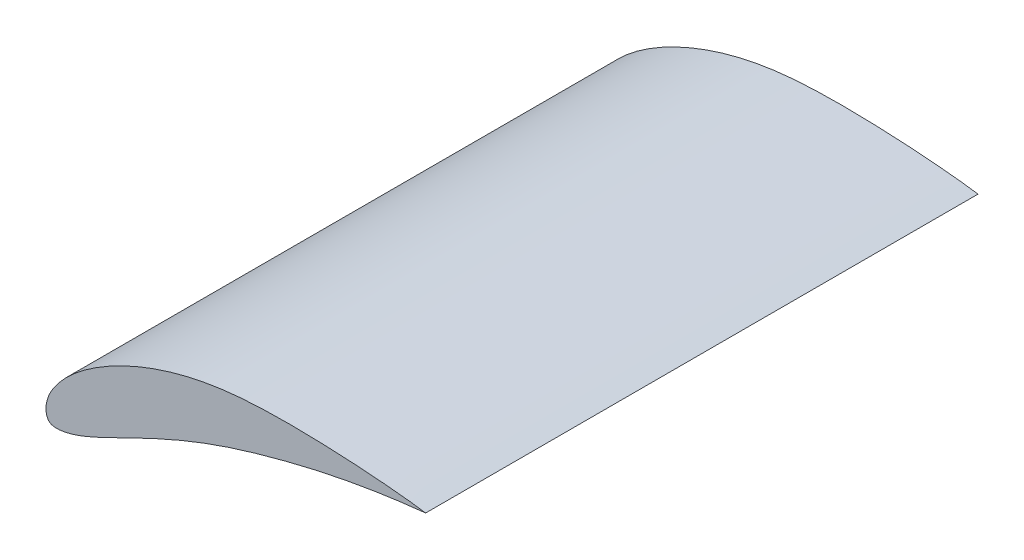
from build123d import *

# Parameters (mm, degrees)
BOSS_EXTRUDE1_DEPTH = 254


with BuildPart() as part:
    # Sketch4 → Boss-Extrude1 (new body)
    with BuildSketch(Plane.XY):
        with BuildLine():
            add(Edge.make_bspline(
                [(643.643746682, 374.253016038), (644.070127169, 375.272815676), (644.568425729, 376.247168181), (645.66595731, 378.132089752), (646.264693913, 379.04297252), (647.541990898, 380.814295075), (648.221792144, 381.676928327), (649.639946963, 383.35186971), (650.374220485, 384.159209796), (652.637702456, 386.508688506), (654.227739569, 387.97808557), (657.526822975, 390.774563344), (659.236808225, 392.100521211), (662.754760091, 394.635266564), (664.564078818, 395.844343958), (668.263555084, 398.158009043), (670.138940349, 399.253043278), (675.831208738, 402.378843705), (679.71306976, 404.25304174), (687.624134138, 407.646407586), (691.655458911, 409.160463714), (697.813800993, 411.163231515), (699.885031735, 411.786364282), (703.019109794, 412.655446416), (704.068342859, 412.934200147), (706.175837552, 413.46995274), (707.234104449, 413.726915239), (712.523410363, 414.952098085), (716.767976429, 415.746567548), (725.281236207, 416.994082048), (729.550126331, 417.444347706), (738.108101863, 418.059100463), (742.396452254, 418.233988614), (750.984850002, 418.418244009), (755.284956147, 418.426779362), (763.894434315, 418.312730873), (768.20498599, 418.190722932), (776.827909215, 417.846034605), (781.135734712, 417.62379177), (789.744487104, 417.084636103), (794.045530081, 416.769316274), (800.491212623, 416.215618502), (802.638777841, 416.01738948), (806.931247773, 415.584421162), (809.077241324, 415.350690101), (813.166057632, 414.850938767), (815.109802966, 414.594474514), (817.043146266, 414.285421762)],
                knots=[0.548290738, 0.548290738, 0.548290738, 0.548290738, 0.556103238, 0.556103238, 0.563915738, 0.563915738, 0.571728238, 0.571728238, 0.579540738, 0.579540738, 0.595165738, 0.595165738, 0.610790738, 0.610790738, 0.626415738, 0.626415738, 0.642040738, 0.642040738, 0.673290738, 0.673290738, 0.704540738, 0.704540738, 0.720165738, 0.720165738, 0.727978238, 0.727978238, 0.735790738, 0.735790738, 0.767040738, 0.767040738, 0.798290738, 0.798290738, 0.829540738, 0.829540738, 0.860790738, 0.860790738, 0.892040738, 0.892040738, 0.923290738, 0.923290738, 0.954540738, 0.954540738, 0.970165738, 0.970165738, 0.985790738, 0.985790738, 1, 1, 1, 1], degree=3))
            add(Edge.make_bspline(
                [(643.643746682, 374.253016038), (643.617138135, 374.184078824), (643.589417917, 374.111226627), (643.536192924, 373.969133145), (643.457469514, 373.755686011), (643.382181674, 373.541292436), (643.236438857, 373.111173912), (643.145718636, 372.822653661), (642.894970722, 371.951194052), (642.756237725, 371.362388362), (642.548266529, 370.165632327), (642.480488302, 369.561670508), (642.438540803, 368.356846725), (642.460803612, 367.753826324), (642.637736209, 366.545922031), (642.79440566, 365.95981624), (643.104100127, 365.264567081), (643.17214484, 365.126592853), (643.32195874, 364.861040293), (643.403948785, 364.733293977), (643.579817163, 364.486243652), (643.673325653, 364.366677003), (643.882500621, 364.143278901), (643.996016029, 364.038173213), (644.237909259, 363.855539706), (644.367754436, 363.777678285), (644.639031983, 363.639476204), (644.780130601, 363.57746722), (645.207990721, 363.419816375), (645.502350869, 363.349487624), (646.099278537, 363.240122132), (646.402918322, 363.205248637), (647.008369674, 363.16171122), (647.311567796, 363.152642426), (647.918781712, 363.156484916), (648.224053481, 363.169569872), (648.825248237, 363.21360816), (649.122121972, 363.244471002), (650.004207275, 363.357332398), (650.581029895, 363.45925481), (652.294582988, 363.805194822), (653.412147539, 364.094731727), (656.717353444, 365.076126423), (658.860164815, 365.874455979), (663.094560197, 367.592780706), (665.183901776, 368.518101678), (669.332696868, 370.439728147), (671.391847766, 371.43675236), (675.500510569, 373.453693511), (677.550046799, 374.473552679), (681.654087685, 376.50147094), (683.7094473, 377.507499497), (689.894945053, 380.47946502), (694.0437618, 382.401040058), (700.317080433, 385.164429906), (702.41629012, 386.066314001), (706.632667908, 387.827430735), (708.750650322, 388.686798579), (715.125529521, 391.188567743), (719.406419698, 392.751975841), (728.026594361, 395.681877415), (732.366240875, 397.047150079), (741.088732972, 399.632021481), (745.471041032, 400.853432832), (754.27276127, 403.171134724), (758.692058589, 404.267812586), (767.568444841, 406.333729163), (772.028934215, 407.303713772), (780.970063112, 409.091207648), (785.45164199, 409.90929889), (794.436618151, 411.395615522), (798.939714211, 412.065909951), (807.965019934, 413.275211663), (812.487344734, 413.813428092), (817.027491887, 414.283800548), (817.035319061, 414.284611258), (817.043146266, 414.285421762)],
                knots=[0, 0, 0, 0, 0.000488281, 0.000488281, 0.000976563, 0.001953125, 0.001953125, 0.00390625, 0.00390625, 0.0078125, 0.0078125, 0.01171875, 0.01171875, 0.015625, 0.015625, 0.01953125, 0.01953125, 0.020507813, 0.020507813, 0.021484375, 0.021484375, 0.022460938, 0.022460938, 0.0234375, 0.0234375, 0.024414063, 0.024414063, 0.025390625, 0.025390625, 0.02734375, 0.02734375, 0.029296875, 0.029296875, 0.03125, 0.03125, 0.033203125, 0.033203125, 0.03515625, 0.03515625, 0.0390625, 0.0390625, 0.046875, 0.046875, 0.0625, 0.0625, 0.078125, 0.078125, 0.09375, 0.09375, 0.109375, 0.109375, 0.125, 0.125, 0.15625, 0.15625, 0.171875, 0.171875, 0.1875, 0.1875, 0.21875, 0.21875, 0.25, 0.25, 0.28125, 0.28125, 0.3125, 0.3125, 0.34375, 0.34375, 0.375, 0.375, 0.40625, 0.40625, 0.4375, 0.4375, 0.437553968, 0.437553968, 0.437553968, 0.437553968], degree=3))
        make_face()
    extrude(amount=BOSS_EXTRUDE1_DEPTH)


solid = part.part
